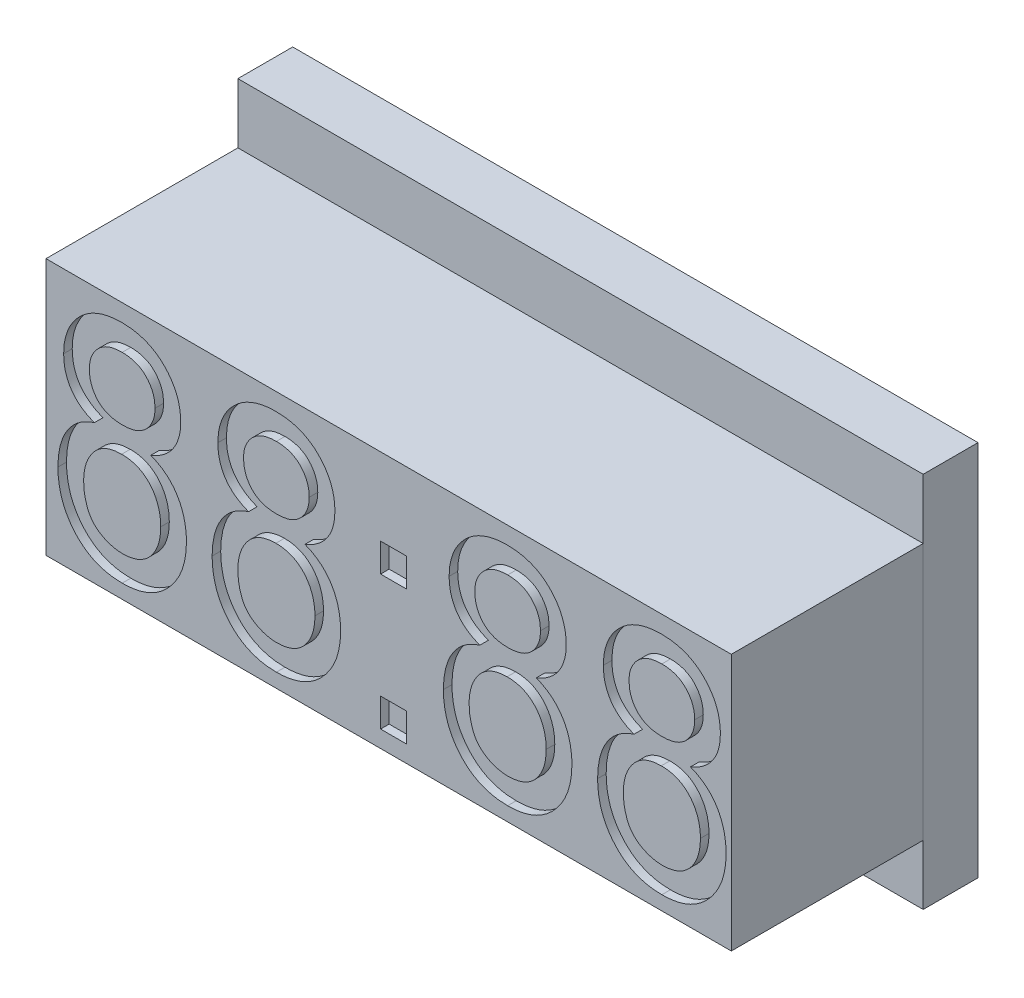
from build123d import *

# Parameters (mm, degrees)
SKETCH1_W           = 50.8
SKETCH1_H           = 19.05
BOSS_EXTRUDE1_DEPTH = 14.224
SKETCH2_W           = 1.905
SKETCH2_H           = 2.116666667
SKETCH2_H_2         = 2.116666666
CUT_EXTRUDE1_DEPTH  = 0.635
SKETCH3_W           = 50.8
SKETCH3_H           = 27.94
BOSS_EXTRUDE2_DEPTH = 4.064


with BuildPart() as part:
    # Sketch1 → Boss-Extrude1 (new body)
    with BuildSketch(Plane.XY):
        with Locations((25.4, 9.525)):
            Rectangle(SKETCH1_W, SKETCH1_H)
    extrude(amount=BOSS_EXTRUDE1_DEPTH)

    # Sketch2 → Cut-Extrude1 (cut)
    # profile 1 of 6: a face of its own
    with BuildSketch(Plane.XY.offset(14.224)):
        with BuildLine():
            add(Edge.make_bspline(
                [(3.58030085, 10.308018489), (3.397034277, 10.386844296), (3.04416725, 10.538617901), (2.571057708, 10.839456798), (2.175325296, 11.190581653), (1.851122016, 11.5879075), (1.610285421, 12.035650596), (1.432031058, 12.519376367), (1.329186423, 13.046584041), (1.315334082, 13.410915478), (1.308191475, 13.598773697)],
                knots=[0, 0, 0, 0, 1.116313665, 2.149384251, 3.124879036, 4.069141594, 5.006125591, 5.959573231, 6.947905943, 8, 8, 8, 8], degree=3))
            add(Edge.make_bspline(
                [(1.308191475, 13.598773697), (1.312460875, 13.743331931), (1.320833067, 14.02680717), (1.373235641, 14.443730648), (1.466949805, 14.842132487), (1.595270673, 15.223750118), (1.762568555, 15.586718904), (1.964853676, 15.933515643), (2.207721554, 16.259616945), (2.481364948, 16.568325012), (2.787516809, 16.847271151), (3.119303045, 17.095217826), (3.479282646, 17.299841695), (3.861553599, 17.469170502), (4.266749849, 17.602620741), (4.697083774, 17.693790262), (5.150817905, 17.75119872), (5.461973155, 17.758781103), (5.620899808, 17.762653906)],
                knots=[0, 0, 0, 0, 1.031939473, 2.023608621, 2.993271962, 3.948847435, 4.892522375, 5.841301836, 6.809239398, 7.790140986, 8.781591557, 9.760534184, 10.740488377, 11.730438833, 12.740759373, 13.779517113, 14.865859038, 16, 16, 16, 16], degree=3))
            add(Edge.make_bspline(
                [(5.620899808, 17.762653906), (5.780909355, 17.758687179), (6.094223799, 17.750919937), (6.551741203, 17.69477941), (6.986031852, 17.598577332), (7.395752709, 17.462885727), (7.783057559, 17.291620758), (8.142034168, 17.075790219), (8.481992972, 16.829195498), (8.789797159, 16.540236255), (9.07092386, 16.227842728), (9.315473394, 15.894122795), (9.522445536, 15.543934337), (9.692438623, 15.177433902), (9.825597072, 14.793155344), (9.916460457, 14.391466441), (9.975153965, 13.974219469), (9.982685867, 13.690477625), (9.986524808, 13.545857031)],
                knots=[0, 0, 0, 0, 1.1297157, 2.212094545, 3.248951197, 4.265623506, 5.255202228, 6.232456948, 7.21801653, 8.215068481, 9.207399011, 10.182076979, 11.131305002, 12.075155282, 13.030333639, 13.997146138, 14.979163909, 16, 16, 16, 16], degree=3))
            add(Edge.make_bspline(
                [(9.986524808, 13.545857031), (9.980701026, 13.364561969), (9.969309213, 13.009933431), (9.864773579, 12.496825605), (9.691552728, 12.020370796), (9.448454517, 11.582758288), (9.133640878, 11.18790798), (8.746652195, 10.840666525), (8.288413484, 10.539129314), (7.94516738, 10.386892269), (7.7673321, 10.308018489)],
                knots=[0, 0, 0, 0, 1.036094605, 2.026689038, 2.980283662, 3.925964154, 4.877304315, 5.855050132, 6.888704762, 8, 8, 8, 8], degree=3))
            add(Edge.make_bspline(
                [(7.7673321, 10.308018489), (7.872978974, 10.265929699), (8.081782421, 10.182744234), (8.375076351, 10.024714322), (8.650725938, 9.853102635), (8.908552405, 9.663213914), (9.145318752, 9.452729047), (9.362043984, 9.22149391), (9.561423405, 8.973631854), (9.739217953, 8.704970126), (9.898323587, 8.421281563), (10.033693961, 8.121896915), (10.148684746, 7.811104066), (10.247378542, 7.487144288), (10.317434312, 7.148021679), (10.370559995, 6.795874936), (10.405257747, 6.43146356), (10.408308434, 6.183905079), (10.409858141, 6.058148697)],
                knots=[0, 0, 0, 0, 1.019342711, 2.014657542, 2.983231917, 3.930624061, 4.883266096, 5.820696337, 6.770511154, 7.733211644, 8.707172762, 9.685191965, 10.677111235, 11.67830396, 12.719854286, 13.779970705, 14.872254947, 16, 16, 16, 16], degree=3))
            add(Edge.make_bspline(
                [(10.409858141, 6.058148697), (10.406487936, 5.884858962), (10.399853146, 5.543710353), (10.334232378, 5.042599827), (10.232918036, 4.562121031), (10.090509411, 4.101922016), (9.904424382, 3.66485305), (9.678444346, 3.247667207), (9.408212514, 2.85386346), (9.10419255, 2.481734654), (8.763849036, 2.144816733), (8.396352558, 1.849160557), (8.001678531, 1.598039902), (7.581112009, 1.393166544), (7.134252139, 1.233053336), (6.661747942, 1.121207907), (6.163005986, 1.054409589), (5.82175025, 1.045526678), (5.647358141, 1.040987239)],
                knots=[0, 0, 0, 0, 1.072306727, 2.111007592, 3.12299609, 4.109509213, 5.088129061, 6.059319179, 7.04178692, 8.040617711, 9.029959822, 10.000982057, 10.955237703, 11.919786304, 12.89124018, 13.88778323, 14.920592687, 16, 16, 16, 16], degree=3))
            add(Edge.make_bspline(
                [(5.647358141, 1.040987239), (5.472988116, 1.045625358), (5.131775594, 1.054701369), (4.632465205, 1.120149377), (4.160833399, 1.237092881), (3.714517221, 1.397076973), (3.290579614, 1.597739778), (2.896774431, 1.852287356), (2.526198828, 2.147811343), (2.188678872, 2.488643985), (1.881671756, 2.85971368), (1.615846388, 3.259427835), (1.391064354, 3.680705086), (1.202738553, 4.123564534), (1.062515078, 4.591093202), (0.960353266, 5.078982875), (0.894622523, 5.588931324), (0.888160326, 5.93667534), (0.884858141, 6.114372656)],
                knots=[0, 0, 0, 0, 1.072252422, 2.098215863, 3.089753912, 4.05476847, 5.009968659, 5.96725982, 6.931845598, 7.919412138, 8.911622142, 9.889412638, 10.866097794, 11.844475729, 12.843886458, 13.86243076, 14.90770136, 16, 16, 16, 16], degree=3))
            add(Edge.make_bspline(
                [(0.884858141, 6.114372656), (0.886487753, 6.24672722), (0.88968448, 6.50636045), (0.922819949, 6.886564838), (0.980400098, 7.249561898), (1.054458886, 7.597304362), (1.15512144, 7.928220626), (1.272245804, 8.243604308), (1.416903715, 8.540339947), (1.58082405, 8.820764773), (1.767136089, 9.081743692), (1.96799198, 9.325385651), (2.192133338, 9.54412501), (2.431812289, 9.743414215), (2.694534427, 9.915600906), (2.970863334, 10.071386604), (3.267083388, 10.2057098), (3.474848996, 10.273573919), (3.58030085, 10.308018489)],
                knots=[0, 0, 0, 0, 1.181628645, 2.317940921, 3.403889794, 4.46199846, 5.489724449, 6.489781966, 7.462778676, 8.433532019, 9.386758388, 10.323216551, 11.249007665, 12.179184461, 13.101987708, 14.049504252, 15.010021952, 16, 16, 16, 16], degree=3))
        make_face()
        with BuildLine():
            add(Edge.make_bspline(
                [(3.213191475, 13.588851822), (3.220016361, 13.42045726), (3.233181728, 13.095620162), (3.357106508, 12.633602778), (3.552874552, 12.218070182), (3.784612465, 11.917716244), (4.004349123, 11.709138807), (4.190957732, 11.574386528), (4.393579003, 11.455746014), (4.616899052, 11.367129017), (4.852677148, 11.285973325), (5.109316701, 11.241684179), (5.381711984, 11.204757453), (5.57003622, 11.20227042), (5.667201891, 11.200987239)],
                knots=[0, 0, 0, 0, 1.561875721, 3.012895249, 4.410314951, 5.805592954, 6.508532571, 7.219487384, 7.939899041, 8.683744234, 9.448250894, 10.251837004, 11.098037322, 12, 12, 12, 12], degree=3))
            add(Edge.make_bspline(
                [(5.667201891, 11.200987239), (5.761040682, 11.202413869), (5.944925148, 11.205209464), (6.210974061, 11.240895116), (6.462189097, 11.287690722), (6.694265191, 11.362092793), (6.911908306, 11.453467624), (7.109497079, 11.57127205), (7.295082663, 11.703220304), (7.511729404, 11.910356411), (7.742322743, 12.202366879), (7.939321481, 12.598927066), (8.060014876, 13.032854623), (8.074219404, 13.334497716), (8.081524808, 13.489633072)],
                knots=[0, 0, 0, 0, 0.900694707, 1.764981895, 2.574946967, 3.351982508, 4.101469111, 4.837061144, 5.557246402, 6.283942291, 7.709639718, 9.106732897, 10.511989727, 12, 12, 12, 12], degree=3))
            add(Edge.make_bspline(
                [(8.081524808, 13.489633072), (8.074604096, 13.650326372), (8.061070965, 13.964554657), (7.934258649, 14.414203458), (7.729127556, 14.823284125), (7.492436022, 15.123393771), (7.271925206, 15.338489857), (7.085540712, 15.477224209), (6.883849308, 15.595357715), (6.665579601, 15.689488139), (6.433583759, 15.766984639), (6.184962174, 15.818778568), (5.921732217, 15.85315251), (5.740077739, 15.856132743), (5.647358141, 15.857653906)],
                knots=[0, 0, 0, 0, 1.512185558, 2.957008623, 4.365372594, 5.801985624, 6.537052341, 7.264585772, 7.986529875, 8.735787676, 9.501586748, 10.288465839, 11.126403274, 12, 12, 12, 12], degree=3))
            add(Edge.make_bspline(
                [(5.647358141, 15.857653906), (5.553514219, 15.856284198), (5.370714639, 15.853616131), (5.105809143, 15.817478521), (4.855748562, 15.770816388), (4.621957046, 15.696673141), (4.404243406, 15.601912951), (4.20339521, 15.483757088), (4.017368852, 15.348543189), (3.795039417, 15.143088613), (3.565416864, 14.849770992), (3.358001619, 14.461450126), (3.234770483, 14.034960516), (3.220482136, 13.739573644), (3.213191475, 13.588851822)],
                knots=[0, 0, 0, 0, 0.903435088, 1.759810875, 2.572240282, 3.351639969, 4.117384775, 4.855214862, 5.592433022, 6.329115329, 7.765723387, 9.157858409, 10.549790801, 12, 12, 12, 12], degree=3))
        make_face(mode=Mode.SUBTRACT)
        with BuildLine():
            add(Edge.make_bspline(
                [(2.789858141, 6.154060156), (2.794320844, 6.018330685), (2.803242569, 5.746983668), (2.855207793, 5.343237199), (2.951034843, 4.946679172), (3.075281038, 4.55934468), (3.246749539, 4.191036833), (3.485725801, 3.868731888), (3.776550347, 3.586804805), (4.118562388, 3.358342283), (4.488855038, 3.173075807), (4.874990601, 3.0460729), (5.265518407, 2.960867705), (5.52895932, 2.950945072), (5.660587308, 2.945987239)],
                knots=[0, 0, 0, 0, 1.006868726, 2.012907182, 3.012445859, 4.028567265, 5.026901356, 6.009747568, 6.986966262, 8.016551145, 9.047693155, 10.048301359, 11.024835727, 12, 12, 12, 12], degree=3))
            add(Edge.make_bspline(
                [(5.660587308, 2.945987239), (5.769887649, 2.948073592), (5.982777832, 2.952137294), (6.29173707, 2.996791501), (6.582012966, 3.066093904), (6.855576569, 3.161796777), (7.110169669, 3.286912314), (7.344320861, 3.441893986), (7.561487649, 3.621733044), (7.759053858, 3.829373225), (7.93236444, 4.060952056), (8.0854823, 4.306445347), (8.215610085, 4.566417069), (8.321621066, 4.842273874), (8.40347801, 5.13359831), (8.46403562, 5.438648625), (8.495854927, 5.758718724), (8.501811254, 5.97650724), (8.504858141, 6.087914322)],
                knots=[0, 0, 0, 0, 1.097458311, 2.137578876, 3.128901218, 4.092293367, 5.043381478, 5.971158103, 6.907163069, 7.87080988, 8.843327904, 9.808437727, 10.774373489, 11.75967516, 12.772969041, 13.811318785, 14.880406592, 16, 16, 16, 16], degree=3))
            add(Edge.make_bspline(
                [(8.504858141, 6.087914322), (8.502236331, 6.201575713), (8.497106207, 6.423978099), (8.459260627, 6.750034717), (8.401844634, 7.061624424), (8.314111515, 7.357652746), (8.205535934, 7.639051032), (8.073473499, 7.906081978), (7.912253549, 8.154645569), (7.73255138, 8.388560736), (7.530729552, 8.601596162), (7.30781818, 8.786507534), (7.070271135, 8.947676042), (6.811017148, 9.073519516), (6.534915512, 9.173085703), (6.240216524, 9.245556692), (5.927604704, 9.289523896), (5.713649558, 9.293802017), (5.60436335, 9.295987239)],
                knots=[0, 0, 0, 0, 1.12067967, 2.192845172, 3.233399502, 4.241469031, 5.232807671, 6.205245886, 7.17335929, 8.149800574, 9.111052183, 10.06042534, 11.001231045, 11.934784394, 12.894312888, 13.891062058, 14.922775011, 16, 16, 16, 16], degree=3))
            add(Edge.make_bspline(
                [(5.60436335, 9.295987239), (5.497247132, 9.293925112), (5.287614025, 9.289889402), (4.982282527, 9.244271661), (4.693822395, 9.178193197), (4.425833105, 9.075010285), (4.172812519, 8.951690705), (3.940677195, 8.792964297), (3.722953453, 8.611470425), (3.53045136, 8.398218493), (3.354897501, 8.169083908), (3.206554532, 7.921192327), (3.07576546, 7.662432109), (2.969478412, 7.387937207), (2.892211464, 7.097916975), (2.83038869, 6.796811976), (2.79893373, 6.47993497), (2.792929942, 6.264358489), (2.789858141, 6.154060156)],
                knots=[0, 0, 0, 0, 1.081998423, 2.11753828, 3.115013709, 4.067255809, 5.014265771, 5.953967889, 6.902943283, 7.873083686, 8.85163808, 9.816900795, 10.788832071, 11.780249459, 12.786095458, 13.819954632, 14.884593666, 16, 16, 16, 16], degree=3))
        make_face(mode=Mode.SUBTRACT)
    # profile 2 of 6: a face of its own
    with BuildSketch(Plane.XY.offset(14.224)):
        with BuildLine():
            add(Edge.make_bspline(
                [(15.01030085, 10.308018489), (14.827034277, 10.386844296), (14.47416725, 10.538617901), (14.001057708, 10.839456798), (13.605325296, 11.190581653), (13.281122016, 11.5879075), (13.040285421, 12.035650596), (12.862031058, 12.519376367), (12.759186423, 13.046584041), (12.745334082, 13.410915478), (12.738191475, 13.598773697)],
                knots=[0, 0, 0, 0, 1.116313665, 2.149384251, 3.124879036, 4.069141594, 5.006125591, 5.959573231, 6.947905943, 8, 8, 8, 8], degree=3))
            add(Edge.make_bspline(
                [(12.738191475, 13.598773697), (12.742460875, 13.743331931), (12.750833067, 14.02680717), (12.803235641, 14.443730648), (12.896949805, 14.842132487), (13.025270673, 15.223750118), (13.192568555, 15.586718904), (13.394853676, 15.933515643), (13.637721554, 16.259616945), (13.911364948, 16.568325012), (14.217516809, 16.847271151), (14.549303045, 17.095217826), (14.909282646, 17.299841695), (15.291553599, 17.469170502), (15.696749849, 17.602620741), (16.127083774, 17.693790262), (16.580817905, 17.75119872), (16.891973155, 17.758781103), (17.050899808, 17.762653906)],
                knots=[0, 0, 0, 0, 1.031939473, 2.023608621, 2.993271962, 3.948847435, 4.892522375, 5.841301836, 6.809239398, 7.790140986, 8.781591557, 9.760534184, 10.740488377, 11.730438833, 12.740759373, 13.779517113, 14.865859038, 16, 16, 16, 16], degree=3))
            add(Edge.make_bspline(
                [(17.050899808, 17.762653906), (17.210909355, 17.758687179), (17.524223799, 17.750919937), (17.981741203, 17.69477941), (18.416031852, 17.598577332), (18.825752709, 17.462885727), (19.213057559, 17.291620758), (19.572034168, 17.075790219), (19.911992972, 16.829195498), (20.219797159, 16.540236255), (20.50092386, 16.227842728), (20.745473394, 15.894122795), (20.952445536, 15.543934337), (21.122438623, 15.177433902), (21.255597072, 14.793155344), (21.346460457, 14.391466441), (21.405153965, 13.974219469), (21.412685867, 13.690477625), (21.416524808, 13.545857031)],
                knots=[0, 0, 0, 0, 1.1297157, 2.212094545, 3.248951197, 4.265623506, 5.255202228, 6.232456948, 7.21801653, 8.215068481, 9.207399011, 10.182076979, 11.131305002, 12.075155282, 13.030333639, 13.997146138, 14.979163909, 16, 16, 16, 16], degree=3))
            add(Edge.make_bspline(
                [(21.416524808, 13.545857031), (21.410701026, 13.364561969), (21.399309213, 13.009933431), (21.294773579, 12.496825605), (21.121552728, 12.020370796), (20.878454517, 11.582758288), (20.563640878, 11.18790798), (20.176652195, 10.840666525), (19.718413484, 10.539129314), (19.37516738, 10.386892269), (19.1973321, 10.308018489)],
                knots=[0, 0, 0, 0, 1.036094605, 2.026689038, 2.980283662, 3.925964154, 4.877304315, 5.855050132, 6.888704762, 8, 8, 8, 8], degree=3))
            add(Edge.make_bspline(
                [(19.1973321, 10.308018489), (19.302978974, 10.265929699), (19.511782421, 10.182744234), (19.805076351, 10.024714322), (20.080725938, 9.853102635), (20.338552405, 9.663213914), (20.575318752, 9.452729047), (20.792043984, 9.22149391), (20.991423405, 8.973631854), (21.169217953, 8.704970126), (21.328323587, 8.421281563), (21.463693961, 8.121896915), (21.578684746, 7.811104066), (21.677378542, 7.487144288), (21.747434312, 7.148021679), (21.800559995, 6.795874936), (21.835257747, 6.43146356), (21.838308434, 6.183905079), (21.839858141, 6.058148697)],
                knots=[0, 0, 0, 0, 1.019342711, 2.014657542, 2.983231917, 3.930624061, 4.883266096, 5.820696337, 6.770511154, 7.733211644, 8.707172762, 9.685191965, 10.677111235, 11.67830396, 12.719854286, 13.779970705, 14.872254947, 16, 16, 16, 16], degree=3))
            add(Edge.make_bspline(
                [(21.839858141, 6.058148697), (21.836487936, 5.884858962), (21.829853146, 5.543710353), (21.764232378, 5.042599827), (21.662918036, 4.562121031), (21.520509411, 4.101922016), (21.334424382, 3.66485305), (21.108444346, 3.247667207), (20.838212514, 2.85386346), (20.53419255, 2.481734654), (20.193849036, 2.144816733), (19.826352558, 1.849160557), (19.431678531, 1.598039902), (19.011112009, 1.393166544), (18.564252139, 1.233053336), (18.091747942, 1.121207907), (17.593005986, 1.054409589), (17.25175025, 1.045526678), (17.077358141, 1.040987239)],
                knots=[0, 0, 0, 0, 1.072306727, 2.111007592, 3.12299609, 4.109509213, 5.088129061, 6.059319179, 7.04178692, 8.040617711, 9.029959822, 10.000982057, 10.955237703, 11.919786304, 12.89124018, 13.88778323, 14.920592687, 16, 16, 16, 16], degree=3))
            add(Edge.make_bspline(
                [(17.077358141, 1.040987239), (16.902988116, 1.045625358), (16.561775594, 1.054701369), (16.062465205, 1.120149377), (15.590833399, 1.237092881), (15.144517221, 1.397076973), (14.720579614, 1.597739778), (14.326774431, 1.852287356), (13.956198828, 2.147811343), (13.618678872, 2.488643985), (13.311671756, 2.85971368), (13.045846388, 3.259427835), (12.821064354, 3.680705086), (12.632738553, 4.123564534), (12.492515078, 4.591093202), (12.390353266, 5.078982875), (12.324622523, 5.588931324), (12.318160326, 5.93667534), (12.314858141, 6.114372656)],
                knots=[0, 0, 0, 0, 1.072252422, 2.098215863, 3.089753912, 4.05476847, 5.009968659, 5.96725982, 6.931845598, 7.919412138, 8.911622142, 9.889412638, 10.866097794, 11.844475729, 12.843886458, 13.86243076, 14.90770136, 16, 16, 16, 16], degree=3))
            add(Edge.make_bspline(
                [(12.314858141, 6.114372656), (12.316487753, 6.24672722), (12.31968448, 6.50636045), (12.352819949, 6.886564838), (12.410400098, 7.249561898), (12.484458886, 7.597304362), (12.58512144, 7.928220626), (12.702245804, 8.243604308), (12.846903715, 8.540339947), (13.01082405, 8.820764773), (13.197136089, 9.081743692), (13.39799198, 9.325385651), (13.622133338, 9.54412501), (13.861812289, 9.743414215), (14.124534427, 9.915600906), (14.400863334, 10.071386604), (14.697083388, 10.2057098), (14.904848996, 10.273573919), (15.01030085, 10.308018489)],
                knots=[0, 0, 0, 0, 1.181628645, 2.317940921, 3.403889794, 4.46199846, 5.489724449, 6.489781966, 7.462778676, 8.433532019, 9.386758388, 10.323216551, 11.249007665, 12.179184461, 13.101987708, 14.049504252, 15.010021952, 16, 16, 16, 16], degree=3))
        make_face()
        with BuildLine():
            add(Edge.make_bspline(
                [(14.643191475, 13.588851822), (14.650016361, 13.42045726), (14.663181728, 13.095620162), (14.787106508, 12.633602778), (14.982874552, 12.218070182), (15.214612465, 11.917716244), (15.434349123, 11.709138807), (15.620957732, 11.574386528), (15.823579003, 11.455746014), (16.046899052, 11.367129017), (16.282677148, 11.285973325), (16.539316701, 11.241684179), (16.811711984, 11.204757453), (17.00003622, 11.20227042), (17.097201891, 11.200987239)],
                knots=[0, 0, 0, 0, 1.561875721, 3.012895249, 4.410314951, 5.805592954, 6.508532571, 7.219487384, 7.939899041, 8.683744234, 9.448250894, 10.251837004, 11.098037322, 12, 12, 12, 12], degree=3))
            add(Edge.make_bspline(
                [(17.097201891, 11.200987239), (17.191040682, 11.202413869), (17.374925148, 11.205209464), (17.640974061, 11.240895116), (17.892189097, 11.287690722), (18.124265191, 11.362092793), (18.341908306, 11.453467624), (18.539497079, 11.57127205), (18.725082663, 11.703220304), (18.941729404, 11.910356411), (19.172322743, 12.202366879), (19.369321481, 12.598927066), (19.490014876, 13.032854623), (19.504219404, 13.334497716), (19.511524808, 13.489633072)],
                knots=[0, 0, 0, 0, 0.900694707, 1.764981895, 2.574946967, 3.351982508, 4.101469111, 4.837061144, 5.557246402, 6.283942291, 7.709639718, 9.106732897, 10.511989727, 12, 12, 12, 12], degree=3))
            add(Edge.make_bspline(
                [(19.511524808, 13.489633072), (19.504604096, 13.650326372), (19.491070965, 13.964554657), (19.364258649, 14.414203458), (19.159127556, 14.823284125), (18.922436022, 15.123393771), (18.701925206, 15.338489857), (18.515540712, 15.477224209), (18.313849308, 15.595357715), (18.095579601, 15.689488139), (17.863583759, 15.766984639), (17.614962174, 15.818778568), (17.351732217, 15.85315251), (17.170077739, 15.856132743), (17.077358141, 15.857653906)],
                knots=[0, 0, 0, 0, 1.512185558, 2.957008623, 4.365372594, 5.801985624, 6.537052341, 7.264585772, 7.986529875, 8.735787676, 9.501586748, 10.288465839, 11.126403274, 12, 12, 12, 12], degree=3))
            add(Edge.make_bspline(
                [(17.077358141, 15.857653906), (16.983514219, 15.856284198), (16.800714639, 15.853616131), (16.535809143, 15.817478521), (16.285748562, 15.770816388), (16.051957046, 15.696673141), (15.834243406, 15.601912951), (15.63339521, 15.483757088), (15.447368852, 15.348543189), (15.225039417, 15.143088613), (14.995416864, 14.849770992), (14.788001619, 14.461450126), (14.664770483, 14.034960516), (14.650482136, 13.739573644), (14.643191475, 13.588851822)],
                knots=[0, 0, 0, 0, 0.903435088, 1.759810875, 2.572240282, 3.351639969, 4.117384775, 4.855214862, 5.592433022, 6.329115329, 7.765723387, 9.157858409, 10.549790801, 12, 12, 12, 12], degree=3))
        make_face(mode=Mode.SUBTRACT)
        with BuildLine():
            add(Edge.make_bspline(
                [(14.219858141, 6.154060156), (14.224320844, 6.018330685), (14.233242569, 5.746983668), (14.285207793, 5.343237199), (14.381034843, 4.946679172), (14.505281038, 4.55934468), (14.676749539, 4.191036833), (14.915725801, 3.868731888), (15.206550347, 3.586804805), (15.548562388, 3.358342283), (15.918855038, 3.173075807), (16.304990601, 3.0460729), (16.695518407, 2.960867705), (16.95895932, 2.950945072), (17.090587308, 2.945987239)],
                knots=[0, 0, 0, 0, 1.006868726, 2.012907182, 3.012445859, 4.028567265, 5.026901356, 6.009747568, 6.986966262, 8.016551145, 9.047693155, 10.048301359, 11.024835727, 12, 12, 12, 12], degree=3))
            add(Edge.make_bspline(
                [(17.090587308, 2.945987239), (17.199887649, 2.948073592), (17.412777832, 2.952137294), (17.72173707, 2.996791501), (18.012012966, 3.066093904), (18.285576569, 3.161796777), (18.540169669, 3.286912314), (18.774320861, 3.441893986), (18.991487649, 3.621733044), (19.189053858, 3.829373225), (19.36236444, 4.060952056), (19.5154823, 4.306445347), (19.645610085, 4.566417069), (19.751621066, 4.842273874), (19.83347801, 5.13359831), (19.89403562, 5.438648625), (19.925854927, 5.758718724), (19.931811254, 5.97650724), (19.934858141, 6.087914322)],
                knots=[0, 0, 0, 0, 1.097458311, 2.137578876, 3.128901218, 4.092293367, 5.043381478, 5.971158103, 6.907163069, 7.87080988, 8.843327904, 9.808437727, 10.774373489, 11.75967516, 12.772969041, 13.811318785, 14.880406592, 16, 16, 16, 16], degree=3))
            add(Edge.make_bspline(
                [(19.934858141, 6.087914322), (19.932236331, 6.201575713), (19.927106207, 6.423978099), (19.889260627, 6.750034717), (19.831844634, 7.061624424), (19.744111515, 7.357652746), (19.635535934, 7.639051032), (19.503473499, 7.906081978), (19.342253549, 8.154645569), (19.16255138, 8.388560736), (18.960729552, 8.601596162), (18.73781818, 8.786507534), (18.500271135, 8.947676042), (18.241017148, 9.073519516), (17.964915512, 9.173085703), (17.670216524, 9.245556692), (17.357604704, 9.289523896), (17.143649558, 9.293802017), (17.03436335, 9.295987239)],
                knots=[0, 0, 0, 0, 1.12067967, 2.192845172, 3.233399502, 4.241469031, 5.232807671, 6.205245886, 7.17335929, 8.149800574, 9.111052183, 10.06042534, 11.001231045, 11.934784394, 12.894312888, 13.891062058, 14.922775011, 16, 16, 16, 16], degree=3))
            add(Edge.make_bspline(
                [(17.03436335, 9.295987239), (16.927247132, 9.293925112), (16.717614025, 9.289889402), (16.412282527, 9.244271661), (16.123822395, 9.178193197), (15.855833105, 9.075010285), (15.602812519, 8.951690705), (15.370677195, 8.792964297), (15.152953453, 8.611470425), (14.96045136, 8.398218493), (14.784897501, 8.169083908), (14.636554532, 7.921192327), (14.50576546, 7.662432109), (14.399478412, 7.387937207), (14.322211464, 7.097916975), (14.26038869, 6.796811976), (14.22893373, 6.47993497), (14.222929942, 6.264358489), (14.219858141, 6.154060156)],
                knots=[0, 0, 0, 0, 1.081998423, 2.11753828, 3.115013709, 4.067255809, 5.014265771, 5.953967889, 6.902943283, 7.873083686, 8.85163808, 9.816900795, 10.788832071, 11.780249459, 12.786095458, 13.819954632, 14.884593666, 16, 16, 16, 16], degree=3))
        make_face(mode=Mode.SUBTRACT)
    # profile 3 of 6: a face of its own
    with BuildSketch(Plane.XY.offset(14.224)):
        with Locations((25.755691475, 12.259320573)):
            Rectangle(SKETCH2_W, SKETCH2_H)
    # profile 4 of 6: a face of its own
    with BuildSketch(Plane.XY.offset(14.224)):
        with Locations((25.755691475, 2.310987239)):
            Rectangle(SKETCH2_W, SKETCH2_H_2)
    # profile 5 of 6: a face of its own
    with BuildSketch(Plane.XY.offset(14.224)):
        with BuildLine():
            add(Edge.make_bspline(
                [(32.15530085, 10.308018489), (31.972034277, 10.386844296), (31.61916725, 10.538617901), (31.146057708, 10.839456798), (30.750325296, 11.190581653), (30.426122016, 11.5879075), (30.185285421, 12.035650596), (30.007031058, 12.519376367), (29.904186423, 13.046584041), (29.890334082, 13.410915478), (29.883191475, 13.598773697)],
                knots=[0, 0, 0, 0, 1.116313665, 2.149384251, 3.124879036, 4.069141594, 5.006125591, 5.959573231, 6.947905943, 8, 8, 8, 8], degree=3))
            add(Edge.make_bspline(
                [(29.883191475, 13.598773697), (29.887460875, 13.743331931), (29.895833067, 14.02680717), (29.948235641, 14.443730648), (30.041949805, 14.842132487), (30.170270673, 15.223750118), (30.337568555, 15.586718904), (30.539853676, 15.933515643), (30.782721554, 16.259616945), (31.056364948, 16.568325012), (31.362516809, 16.847271151), (31.694303045, 17.095217826), (32.054282646, 17.299841695), (32.436553599, 17.469170502), (32.841749849, 17.602620741), (33.272083774, 17.693790262), (33.725817905, 17.75119872), (34.036973155, 17.758781103), (34.195899808, 17.762653906)],
                knots=[0, 0, 0, 0, 1.031939473, 2.023608621, 2.993271962, 3.948847435, 4.892522375, 5.841301836, 6.809239398, 7.790140986, 8.781591557, 9.760534184, 10.740488377, 11.730438833, 12.740759373, 13.779517113, 14.865859038, 16, 16, 16, 16], degree=3))
            add(Edge.make_bspline(
                [(34.195899808, 17.762653906), (34.355909355, 17.758687179), (34.669223799, 17.750919937), (35.126741203, 17.69477941), (35.561031852, 17.598577332), (35.970752709, 17.462885727), (36.358057559, 17.291620758), (36.717034168, 17.075790219), (37.056992972, 16.829195498), (37.364797159, 16.540236255), (37.64592386, 16.227842728), (37.890473394, 15.894122795), (38.097445536, 15.543934337), (38.267438623, 15.177433902), (38.400597072, 14.793155344), (38.491460457, 14.391466441), (38.550153965, 13.974219469), (38.557685867, 13.690477625), (38.561524808, 13.545857031)],
                knots=[0, 0, 0, 0, 1.1297157, 2.212094545, 3.248951197, 4.265623506, 5.255202228, 6.232456948, 7.21801653, 8.215068481, 9.207399011, 10.182076979, 11.131305002, 12.075155282, 13.030333639, 13.997146138, 14.979163909, 16, 16, 16, 16], degree=3))
            add(Edge.make_bspline(
                [(38.561524808, 13.545857031), (38.555701026, 13.364561969), (38.544309213, 13.009933431), (38.439773579, 12.496825605), (38.266552728, 12.020370796), (38.023454517, 11.582758288), (37.708640878, 11.18790798), (37.321652195, 10.840666525), (36.863413484, 10.539129314), (36.52016738, 10.386892269), (36.3423321, 10.308018489)],
                knots=[0, 0, 0, 0, 1.036094605, 2.026689038, 2.980283662, 3.925964154, 4.877304315, 5.855050132, 6.888704762, 8, 8, 8, 8], degree=3))
            add(Edge.make_bspline(
                [(36.3423321, 10.308018489), (36.447978974, 10.265929699), (36.656782421, 10.182744234), (36.950076351, 10.024714322), (37.225725938, 9.853102635), (37.483552405, 9.663213914), (37.720318752, 9.452729047), (37.937043984, 9.22149391), (38.136423405, 8.973631854), (38.314217953, 8.704970126), (38.473323587, 8.421281563), (38.608693961, 8.121896915), (38.723684746, 7.811104066), (38.822378542, 7.487144288), (38.892434312, 7.148021679), (38.945559995, 6.795874936), (38.980257747, 6.43146356), (38.983308434, 6.183905079), (38.984858141, 6.058148697)],
                knots=[0, 0, 0, 0, 1.019342711, 2.014657542, 2.983231917, 3.930624061, 4.883266096, 5.820696337, 6.770511154, 7.733211644, 8.707172762, 9.685191965, 10.677111235, 11.67830396, 12.719854286, 13.779970705, 14.872254947, 16, 16, 16, 16], degree=3))
            add(Edge.make_bspline(
                [(38.984858141, 6.058148697), (38.981487936, 5.884858962), (38.974853146, 5.543710353), (38.909232378, 5.042599827), (38.807918036, 4.562121031), (38.665509411, 4.101922016), (38.479424382, 3.66485305), (38.253444346, 3.247667207), (37.983212514, 2.85386346), (37.67919255, 2.481734654), (37.338849036, 2.144816733), (36.971352558, 1.849160557), (36.576678531, 1.598039902), (36.156112009, 1.393166544), (35.709252139, 1.233053336), (35.236747942, 1.121207907), (34.738005986, 1.054409589), (34.39675025, 1.045526678), (34.222358141, 1.040987239)],
                knots=[0, 0, 0, 0, 1.072306727, 2.111007592, 3.12299609, 4.109509213, 5.088129061, 6.059319179, 7.04178692, 8.040617711, 9.029959822, 10.000982057, 10.955237703, 11.919786304, 12.89124018, 13.88778323, 14.920592687, 16, 16, 16, 16], degree=3))
            add(Edge.make_bspline(
                [(34.222358141, 1.040987239), (34.047988116, 1.045625358), (33.706775594, 1.054701369), (33.207465205, 1.120149377), (32.735833399, 1.237092881), (32.289517221, 1.397076973), (31.865579614, 1.597739778), (31.471774431, 1.852287356), (31.101198828, 2.147811343), (30.763678872, 2.488643985), (30.456671756, 2.85971368), (30.190846388, 3.259427835), (29.966064354, 3.680705086), (29.777738553, 4.123564534), (29.637515078, 4.591093202), (29.535353266, 5.078982875), (29.469622523, 5.588931324), (29.463160326, 5.93667534), (29.459858141, 6.114372656)],
                knots=[0, 0, 0, 0, 1.072252422, 2.098215863, 3.089753912, 4.05476847, 5.009968659, 5.96725982, 6.931845598, 7.919412138, 8.911622142, 9.889412638, 10.866097794, 11.844475729, 12.843886458, 13.86243076, 14.90770136, 16, 16, 16, 16], degree=3))
            add(Edge.make_bspline(
                [(29.459858141, 6.114372656), (29.461487753, 6.24672722), (29.46468448, 6.50636045), (29.497819949, 6.886564838), (29.555400098, 7.249561898), (29.629458886, 7.597304362), (29.73012144, 7.928220626), (29.847245804, 8.243604308), (29.991903715, 8.540339947), (30.15582405, 8.820764773), (30.342136089, 9.081743692), (30.54299198, 9.325385651), (30.767133338, 9.54412501), (31.006812289, 9.743414215), (31.269534427, 9.915600906), (31.545863334, 10.071386604), (31.842083388, 10.2057098), (32.049848996, 10.273573919), (32.15530085, 10.308018489)],
                knots=[0, 0, 0, 0, 1.181628645, 2.317940921, 3.403889794, 4.46199846, 5.489724449, 6.489781966, 7.462778676, 8.433532019, 9.386758388, 10.323216551, 11.249007665, 12.179184461, 13.101987708, 14.049504252, 15.010021952, 16, 16, 16, 16], degree=3))
        make_face()
        with BuildLine():
            add(Edge.make_bspline(
                [(31.788191475, 13.588851822), (31.795016361, 13.42045726), (31.808181728, 13.095620162), (31.932106508, 12.633602778), (32.127874552, 12.218070182), (32.359612465, 11.917716244), (32.579349123, 11.709138807), (32.765957732, 11.574386528), (32.968579003, 11.455746014), (33.191899052, 11.367129017), (33.427677148, 11.285973325), (33.684316701, 11.241684179), (33.956711984, 11.204757453), (34.14503622, 11.20227042), (34.242201891, 11.200987239)],
                knots=[0, 0, 0, 0, 1.561875721, 3.012895249, 4.410314951, 5.805592954, 6.508532571, 7.219487384, 7.939899041, 8.683744234, 9.448250894, 10.251837004, 11.098037322, 12, 12, 12, 12], degree=3))
            add(Edge.make_bspline(
                [(34.242201891, 11.200987239), (34.336040682, 11.202413869), (34.519925148, 11.205209464), (34.785974061, 11.240895116), (35.037189097, 11.287690722), (35.269265191, 11.362092793), (35.486908306, 11.453467624), (35.684497079, 11.57127205), (35.870082663, 11.703220304), (36.086729404, 11.910356411), (36.317322743, 12.202366879), (36.514321481, 12.598927066), (36.635014876, 13.032854623), (36.649219404, 13.334497716), (36.656524808, 13.489633072)],
                knots=[0, 0, 0, 0, 0.900694707, 1.764981895, 2.574946967, 3.351982508, 4.101469111, 4.837061144, 5.557246402, 6.283942291, 7.709639718, 9.106732897, 10.511989727, 12, 12, 12, 12], degree=3))
            add(Edge.make_bspline(
                [(36.656524808, 13.489633072), (36.649604096, 13.650326372), (36.636070965, 13.964554657), (36.509258649, 14.414203458), (36.304127556, 14.823284125), (36.067436022, 15.123393771), (35.846925206, 15.338489857), (35.660540712, 15.477224209), (35.458849308, 15.595357715), (35.240579601, 15.689488139), (35.008583759, 15.766984639), (34.759962174, 15.818778568), (34.496732217, 15.85315251), (34.315077739, 15.856132743), (34.222358141, 15.857653906)],
                knots=[0, 0, 0, 0, 1.512185558, 2.957008623, 4.365372594, 5.801985624, 6.537052341, 7.264585772, 7.986529875, 8.735787676, 9.501586748, 10.288465839, 11.126403274, 12, 12, 12, 12], degree=3))
            add(Edge.make_bspline(
                [(34.222358141, 15.857653906), (34.128514219, 15.856284198), (33.945714639, 15.853616131), (33.680809143, 15.817478521), (33.430748562, 15.770816388), (33.196957046, 15.696673141), (32.979243406, 15.601912951), (32.77839521, 15.483757088), (32.592368852, 15.348543189), (32.370039417, 15.143088613), (32.140416864, 14.849770992), (31.933001619, 14.461450126), (31.809770483, 14.034960516), (31.795482136, 13.739573644), (31.788191475, 13.588851822)],
                knots=[0, 0, 0, 0, 0.903435088, 1.759810875, 2.572240282, 3.351639969, 4.117384775, 4.855214862, 5.592433022, 6.329115329, 7.765723387, 9.157858409, 10.549790801, 12, 12, 12, 12], degree=3))
        make_face(mode=Mode.SUBTRACT)
        with BuildLine():
            add(Edge.make_bspline(
                [(31.364858141, 6.154060156), (31.369320844, 6.018330685), (31.378242569, 5.746983668), (31.430207793, 5.343237199), (31.526034843, 4.946679172), (31.650281038, 4.55934468), (31.821749539, 4.191036833), (32.060725801, 3.868731888), (32.351550347, 3.586804805), (32.693562388, 3.358342283), (33.063855038, 3.173075807), (33.449990601, 3.0460729), (33.840518407, 2.960867705), (34.10395932, 2.950945072), (34.235587308, 2.945987239)],
                knots=[0, 0, 0, 0, 1.006868726, 2.012907182, 3.012445859, 4.028567265, 5.026901356, 6.009747568, 6.986966262, 8.016551145, 9.047693155, 10.048301359, 11.024835727, 12, 12, 12, 12], degree=3))
            add(Edge.make_bspline(
                [(34.235587308, 2.945987239), (34.344887649, 2.948073592), (34.557777832, 2.952137294), (34.86673707, 2.996791501), (35.157012966, 3.066093904), (35.430576569, 3.161796777), (35.685169669, 3.286912314), (35.919320861, 3.441893986), (36.136487649, 3.621733044), (36.334053858, 3.829373225), (36.50736444, 4.060952056), (36.6604823, 4.306445347), (36.790610085, 4.566417069), (36.896621066, 4.842273874), (36.97847801, 5.13359831), (37.03903562, 5.438648625), (37.070854927, 5.758718724), (37.076811254, 5.97650724), (37.079858141, 6.087914322)],
                knots=[0, 0, 0, 0, 1.097458311, 2.137578876, 3.128901218, 4.092293367, 5.043381478, 5.971158103, 6.907163069, 7.87080988, 8.843327904, 9.808437727, 10.774373489, 11.75967516, 12.772969041, 13.811318785, 14.880406592, 16, 16, 16, 16], degree=3))
            add(Edge.make_bspline(
                [(37.079858141, 6.087914322), (37.077236331, 6.201575713), (37.072106207, 6.423978099), (37.034260627, 6.750034717), (36.976844634, 7.061624424), (36.889111515, 7.357652746), (36.780535934, 7.639051032), (36.648473499, 7.906081978), (36.487253549, 8.154645569), (36.30755138, 8.388560736), (36.105729552, 8.601596162), (35.88281818, 8.786507534), (35.645271135, 8.947676042), (35.386017148, 9.073519516), (35.109915512, 9.173085703), (34.815216524, 9.245556692), (34.502604704, 9.289523896), (34.288649558, 9.293802017), (34.17936335, 9.295987239)],
                knots=[0, 0, 0, 0, 1.12067967, 2.192845172, 3.233399502, 4.241469031, 5.232807671, 6.205245886, 7.17335929, 8.149800574, 9.111052183, 10.06042534, 11.001231045, 11.934784394, 12.894312888, 13.891062058, 14.922775011, 16, 16, 16, 16], degree=3))
            add(Edge.make_bspline(
                [(34.17936335, 9.295987239), (34.072247132, 9.293925112), (33.862614025, 9.289889402), (33.557282527, 9.244271661), (33.268822395, 9.178193197), (33.000833105, 9.075010285), (32.747812519, 8.951690705), (32.515677195, 8.792964297), (32.297953453, 8.611470425), (32.10545136, 8.398218493), (31.929897501, 8.169083908), (31.781554532, 7.921192327), (31.65076546, 7.662432109), (31.544478412, 7.387937207), (31.467211464, 7.097916975), (31.40538869, 6.796811976), (31.37393373, 6.47993497), (31.367929942, 6.264358489), (31.364858141, 6.154060156)],
                knots=[0, 0, 0, 0, 1.081998423, 2.11753828, 3.115013709, 4.067255809, 5.014265771, 5.953967889, 6.902943283, 7.873083686, 8.85163808, 9.816900795, 10.788832071, 11.780249459, 12.786095458, 13.819954632, 14.884593666, 16, 16, 16, 16], degree=3))
        make_face(mode=Mode.SUBTRACT)
    # profile 6 of 6: a face of its own
    with BuildSketch(Plane.XY.offset(14.224)):
        with BuildLine():
            add(Edge.make_bspline(
                [(43.58530085, 10.308018489), (43.402034277, 10.386844296), (43.04916725, 10.538617901), (42.576057708, 10.839456798), (42.180325296, 11.190581653), (41.856122016, 11.5879075), (41.615285421, 12.035650596), (41.437031058, 12.519376367), (41.334186423, 13.046584041), (41.320334082, 13.410915478), (41.313191475, 13.598773697)],
                knots=[0, 0, 0, 0, 1.116313665, 2.149384251, 3.124879036, 4.069141594, 5.006125591, 5.959573231, 6.947905943, 8, 8, 8, 8], degree=3))
            add(Edge.make_bspline(
                [(41.313191475, 13.598773697), (41.317460875, 13.743331931), (41.325833067, 14.02680717), (41.378235641, 14.443730648), (41.471949805, 14.842132487), (41.600270673, 15.223750118), (41.767568555, 15.586718904), (41.969853676, 15.933515643), (42.212721554, 16.259616945), (42.486364948, 16.568325012), (42.792516809, 16.847271151), (43.124303045, 17.095217826), (43.484282646, 17.299841695), (43.866553599, 17.469170502), (44.271749849, 17.602620741), (44.702083774, 17.693790262), (45.155817905, 17.75119872), (45.466973155, 17.758781103), (45.625899808, 17.762653906)],
                knots=[0, 0, 0, 0, 1.031939473, 2.023608621, 2.993271962, 3.948847435, 4.892522375, 5.841301836, 6.809239398, 7.790140986, 8.781591557, 9.760534184, 10.740488377, 11.730438833, 12.740759373, 13.779517113, 14.865859038, 16, 16, 16, 16], degree=3))
            add(Edge.make_bspline(
                [(45.625899808, 17.762653906), (45.785909355, 17.758687179), (46.099223799, 17.750919937), (46.556741203, 17.69477941), (46.991031852, 17.598577332), (47.400752709, 17.462885727), (47.788057559, 17.291620758), (48.147034168, 17.075790219), (48.486992972, 16.829195498), (48.794797159, 16.540236255), (49.07592386, 16.227842728), (49.320473394, 15.894122795), (49.527445536, 15.543934337), (49.697438623, 15.177433902), (49.830597072, 14.793155344), (49.921460457, 14.391466441), (49.980153965, 13.974219469), (49.987685867, 13.690477625), (49.991524808, 13.545857031)],
                knots=[0, 0, 0, 0, 1.1297157, 2.212094545, 3.248951197, 4.265623506, 5.255202228, 6.232456948, 7.21801653, 8.215068481, 9.207399011, 10.182076979, 11.131305002, 12.075155282, 13.030333639, 13.997146138, 14.979163909, 16, 16, 16, 16], degree=3))
            add(Edge.make_bspline(
                [(49.991524808, 13.545857031), (49.985701026, 13.364561969), (49.974309213, 13.009933431), (49.869773579, 12.496825605), (49.696552728, 12.020370796), (49.453454517, 11.582758288), (49.138640878, 11.18790798), (48.751652195, 10.840666525), (48.293413484, 10.539129314), (47.95016738, 10.386892269), (47.7723321, 10.308018489)],
                knots=[0, 0, 0, 0, 1.036094605, 2.026689038, 2.980283662, 3.925964154, 4.877304315, 5.855050132, 6.888704762, 8, 8, 8, 8], degree=3))
            add(Edge.make_bspline(
                [(47.7723321, 10.308018489), (47.877978974, 10.265929699), (48.086782421, 10.182744234), (48.380076351, 10.024714322), (48.655725938, 9.853102635), (48.913552405, 9.663213914), (49.150318752, 9.452729047), (49.367043984, 9.22149391), (49.566423405, 8.973631854), (49.744217953, 8.704970126), (49.903323587, 8.421281563), (50.038693961, 8.121896915), (50.153684746, 7.811104066), (50.252378542, 7.487144288), (50.322434312, 7.148021679), (50.375559995, 6.795874936), (50.410257747, 6.43146356), (50.413308434, 6.183905079), (50.414858141, 6.058148697)],
                knots=[0, 0, 0, 0, 1.019342711, 2.014657542, 2.983231917, 3.930624061, 4.883266096, 5.820696337, 6.770511154, 7.733211644, 8.707172762, 9.685191965, 10.677111235, 11.67830396, 12.719854286, 13.779970705, 14.872254947, 16, 16, 16, 16], degree=3))
            add(Edge.make_bspline(
                [(50.414858141, 6.058148697), (50.411487936, 5.884858962), (50.404853146, 5.543710353), (50.339232378, 5.042599827), (50.237918036, 4.562121031), (50.095509411, 4.101922016), (49.909424382, 3.66485305), (49.683444346, 3.247667207), (49.413212514, 2.85386346), (49.10919255, 2.481734654), (48.768849036, 2.144816733), (48.401352558, 1.849160557), (48.006678531, 1.598039902), (47.586112009, 1.393166544), (47.139252139, 1.233053336), (46.666747942, 1.121207907), (46.168005986, 1.054409589), (45.82675025, 1.045526678), (45.652358141, 1.040987239)],
                knots=[0, 0, 0, 0, 1.072306727, 2.111007592, 3.12299609, 4.109509213, 5.088129061, 6.059319179, 7.04178692, 8.040617711, 9.029959822, 10.000982057, 10.955237703, 11.919786304, 12.89124018, 13.88778323, 14.920592687, 16, 16, 16, 16], degree=3))
            add(Edge.make_bspline(
                [(45.652358141, 1.040987239), (45.477988116, 1.045625358), (45.136775594, 1.054701369), (44.637465205, 1.120149377), (44.165833399, 1.237092881), (43.719517221, 1.397076973), (43.295579614, 1.597739778), (42.901774431, 1.852287356), (42.531198828, 2.147811343), (42.193678872, 2.488643985), (41.886671756, 2.85971368), (41.620846388, 3.259427835), (41.396064354, 3.680705086), (41.207738553, 4.123564534), (41.067515078, 4.591093202), (40.965353266, 5.078982875), (40.899622523, 5.588931324), (40.893160326, 5.93667534), (40.889858141, 6.114372656)],
                knots=[0, 0, 0, 0, 1.072252422, 2.098215863, 3.089753912, 4.05476847, 5.009968659, 5.96725982, 6.931845598, 7.919412138, 8.911622142, 9.889412638, 10.866097794, 11.844475729, 12.843886458, 13.86243076, 14.90770136, 16, 16, 16, 16], degree=3))
            add(Edge.make_bspline(
                [(40.889858141, 6.114372656), (40.891487753, 6.24672722), (40.89468448, 6.50636045), (40.927819949, 6.886564838), (40.985400098, 7.249561898), (41.059458886, 7.597304362), (41.16012144, 7.928220626), (41.277245804, 8.243604308), (41.421903715, 8.540339947), (41.58582405, 8.820764773), (41.772136089, 9.081743692), (41.97299198, 9.325385651), (42.197133338, 9.54412501), (42.436812289, 9.743414215), (42.699534427, 9.915600906), (42.975863334, 10.071386604), (43.272083388, 10.2057098), (43.479848996, 10.273573919), (43.58530085, 10.308018489)],
                knots=[0, 0, 0, 0, 1.181628645, 2.317940921, 3.403889794, 4.46199846, 5.489724449, 6.489781966, 7.462778676, 8.433532019, 9.386758388, 10.323216551, 11.249007665, 12.179184461, 13.101987708, 14.049504252, 15.010021952, 16, 16, 16, 16], degree=3))
        make_face()
        with BuildLine():
            add(Edge.make_bspline(
                [(43.218191475, 13.588851822), (43.225016361, 13.42045726), (43.238181728, 13.095620162), (43.362106508, 12.633602778), (43.557874552, 12.218070182), (43.789612465, 11.917716244), (44.009349123, 11.709138807), (44.195957732, 11.574386528), (44.398579003, 11.455746014), (44.621899052, 11.367129017), (44.857677148, 11.285973325), (45.114316701, 11.241684179), (45.386711984, 11.204757453), (45.57503622, 11.20227042), (45.672201891, 11.200987239)],
                knots=[0, 0, 0, 0, 1.561875721, 3.012895249, 4.410314951, 5.805592954, 6.508532571, 7.219487384, 7.939899041, 8.683744234, 9.448250894, 10.251837004, 11.098037322, 12, 12, 12, 12], degree=3))
            add(Edge.make_bspline(
                [(45.672201891, 11.200987239), (45.766040682, 11.202413869), (45.949925148, 11.205209464), (46.215974061, 11.240895116), (46.467189097, 11.287690722), (46.699265191, 11.362092793), (46.916908306, 11.453467624), (47.114497079, 11.57127205), (47.300082663, 11.703220304), (47.516729404, 11.910356411), (47.747322743, 12.202366879), (47.944321481, 12.598927066), (48.065014876, 13.032854623), (48.079219404, 13.334497716), (48.086524808, 13.489633072)],
                knots=[0, 0, 0, 0, 0.900694707, 1.764981895, 2.574946967, 3.351982508, 4.101469111, 4.837061144, 5.557246402, 6.283942291, 7.709639718, 9.106732897, 10.511989727, 12, 12, 12, 12], degree=3))
            add(Edge.make_bspline(
                [(48.086524808, 13.489633072), (48.079604096, 13.650326372), (48.066070965, 13.964554657), (47.939258649, 14.414203458), (47.734127556, 14.823284125), (47.497436022, 15.123393771), (47.276925206, 15.338489857), (47.090540712, 15.477224209), (46.888849308, 15.595357715), (46.670579601, 15.689488139), (46.438583759, 15.766984639), (46.189962174, 15.818778568), (45.926732217, 15.85315251), (45.745077739, 15.856132743), (45.652358141, 15.857653906)],
                knots=[0, 0, 0, 0, 1.512185558, 2.957008623, 4.365372594, 5.801985624, 6.537052341, 7.264585772, 7.986529875, 8.735787676, 9.501586748, 10.288465839, 11.126403274, 12, 12, 12, 12], degree=3))
            add(Edge.make_bspline(
                [(45.652358141, 15.857653906), (45.558514219, 15.856284198), (45.375714639, 15.853616131), (45.110809143, 15.817478521), (44.860748562, 15.770816388), (44.626957046, 15.696673141), (44.409243406, 15.601912951), (44.20839521, 15.483757088), (44.022368852, 15.348543189), (43.800039417, 15.143088613), (43.570416864, 14.849770992), (43.363001619, 14.461450126), (43.239770483, 14.034960516), (43.225482136, 13.739573644), (43.218191475, 13.588851822)],
                knots=[0, 0, 0, 0, 0.903435088, 1.759810875, 2.572240282, 3.351639969, 4.117384775, 4.855214862, 5.592433022, 6.329115329, 7.765723387, 9.157858409, 10.549790801, 12, 12, 12, 12], degree=3))
        make_face(mode=Mode.SUBTRACT)
        with BuildLine():
            add(Edge.make_bspline(
                [(42.794858141, 6.154060156), (42.799320844, 6.018330685), (42.808242569, 5.746983668), (42.860207793, 5.343237199), (42.956034843, 4.946679172), (43.080281038, 4.55934468), (43.251749539, 4.191036833), (43.490725801, 3.868731888), (43.781550347, 3.586804805), (44.123562388, 3.358342283), (44.493855038, 3.173075807), (44.879990601, 3.0460729), (45.270518407, 2.960867705), (45.53395932, 2.950945072), (45.665587308, 2.945987239)],
                knots=[0, 0, 0, 0, 1.006868726, 2.012907182, 3.012445859, 4.028567265, 5.026901356, 6.009747568, 6.986966262, 8.016551145, 9.047693155, 10.048301359, 11.024835727, 12, 12, 12, 12], degree=3))
            add(Edge.make_bspline(
                [(45.665587308, 2.945987239), (45.774887649, 2.948073592), (45.987777832, 2.952137294), (46.29673707, 2.996791501), (46.587012966, 3.066093904), (46.860576569, 3.161796777), (47.115169669, 3.286912314), (47.349320861, 3.441893986), (47.566487649, 3.621733044), (47.764053858, 3.829373225), (47.93736444, 4.060952056), (48.0904823, 4.306445347), (48.220610085, 4.566417069), (48.326621066, 4.842273874), (48.40847801, 5.13359831), (48.46903562, 5.438648625), (48.500854927, 5.758718724), (48.506811254, 5.97650724), (48.509858141, 6.087914322)],
                knots=[0, 0, 0, 0, 1.097458311, 2.137578876, 3.128901218, 4.092293367, 5.043381478, 5.971158103, 6.907163069, 7.87080988, 8.843327904, 9.808437727, 10.774373489, 11.75967516, 12.772969041, 13.811318785, 14.880406592, 16, 16, 16, 16], degree=3))
            add(Edge.make_bspline(
                [(48.509858141, 6.087914322), (48.507236331, 6.201575713), (48.502106207, 6.423978099), (48.464260627, 6.750034717), (48.406844634, 7.061624424), (48.319111515, 7.357652746), (48.210535934, 7.639051032), (48.078473499, 7.906081978), (47.917253549, 8.154645569), (47.73755138, 8.388560736), (47.535729552, 8.601596162), (47.31281818, 8.786507534), (47.075271135, 8.947676042), (46.816017148, 9.073519516), (46.539915512, 9.173085703), (46.245216524, 9.245556692), (45.932604704, 9.289523896), (45.718649558, 9.293802017), (45.60936335, 9.295987239)],
                knots=[0, 0, 0, 0, 1.12067967, 2.192845172, 3.233399502, 4.241469031, 5.232807671, 6.205245886, 7.17335929, 8.149800574, 9.111052183, 10.06042534, 11.001231045, 11.934784394, 12.894312888, 13.891062058, 14.922775011, 16, 16, 16, 16], degree=3))
            add(Edge.make_bspline(
                [(45.60936335, 9.295987239), (45.502247132, 9.293925112), (45.292614025, 9.289889402), (44.987282527, 9.244271661), (44.698822395, 9.178193197), (44.430833105, 9.075010285), (44.177812519, 8.951690705), (43.945677195, 8.792964297), (43.727953453, 8.611470425), (43.53545136, 8.398218493), (43.359897501, 8.169083908), (43.211554532, 7.921192327), (43.08076546, 7.662432109), (42.974478412, 7.387937207), (42.897211464, 7.097916975), (42.83538869, 6.796811976), (42.80393373, 6.47993497), (42.797929942, 6.264358489), (42.794858141, 6.154060156)],
                knots=[0, 0, 0, 0, 1.081998423, 2.11753828, 3.115013709, 4.067255809, 5.014265771, 5.953967889, 6.902943283, 7.873083686, 8.85163808, 9.816900795, 10.788832071, 11.780249459, 12.786095458, 13.819954632, 14.884593666, 16, 16, 16, 16], degree=3))
        make_face(mode=Mode.SUBTRACT)
    extrude(amount=-CUT_EXTRUDE1_DEPTH, mode=Mode.SUBTRACT)


with BuildPart() as body_2:
    # Sketch3 → Boss-Extrude2 (new body)
    with BuildSketch(Plane(origin=(0, 0, 0), x_dir=(-1, 0, 0), z_dir=(0, 0, -1))):
        with Locations((-25.4, 9.525)):
            Rectangle(SKETCH3_W, SKETCH3_H)
    extrude(amount=BOSS_EXTRUDE2_DEPTH)


solid = Compound([part.part, body_2.part])
